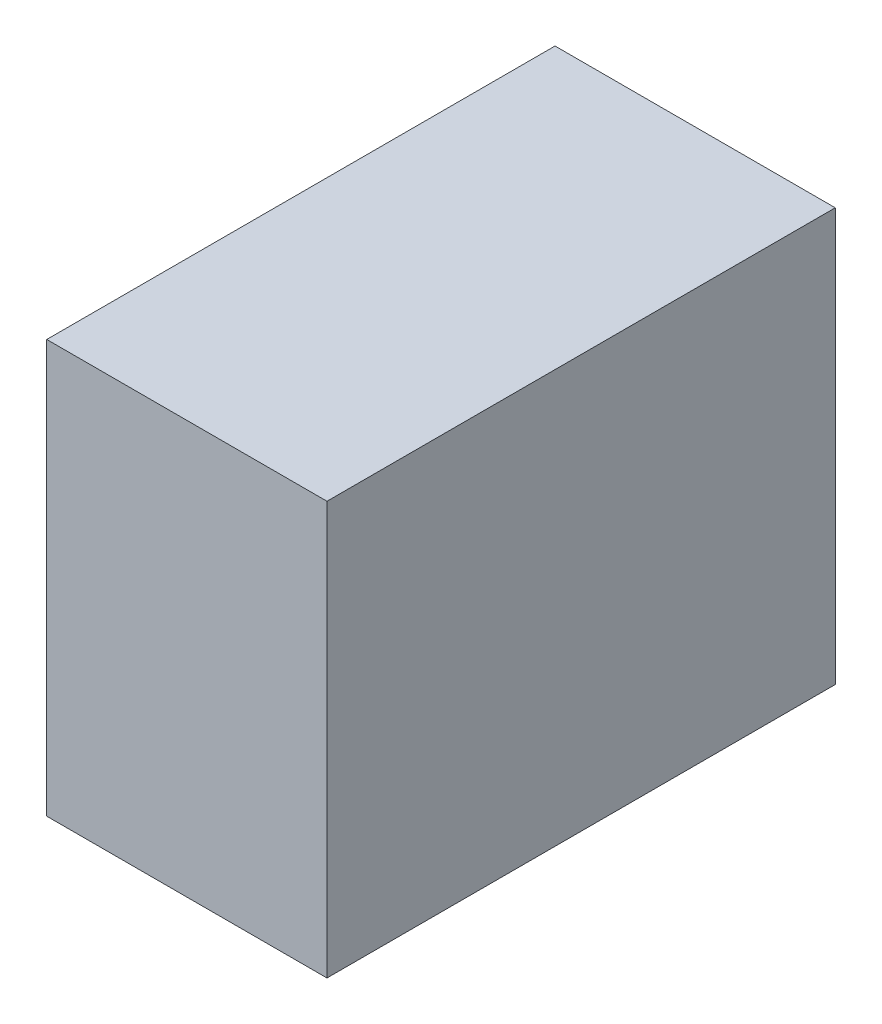
from build123d import *

# Parameters (mm, degrees)
SKETCH_1_W      = 68.2
SKETCH_1_H      = 55.4
EXTRUDE_1_DEPTH = 37.6


with BuildPart() as part:
    # 草图1 → 凸台-拉伸1 (new body)
    with BuildSketch(Plane(origin=(0, 0, 0), x_dir=(0, 0, -1), z_dir=(1, 0, 0))):
        with Locations((34.1, 27.7)):
            Rectangle(SKETCH_1_W, SKETCH_1_H)
    extrude(amount=EXTRUDE_1_DEPTH)


solid = part.part
